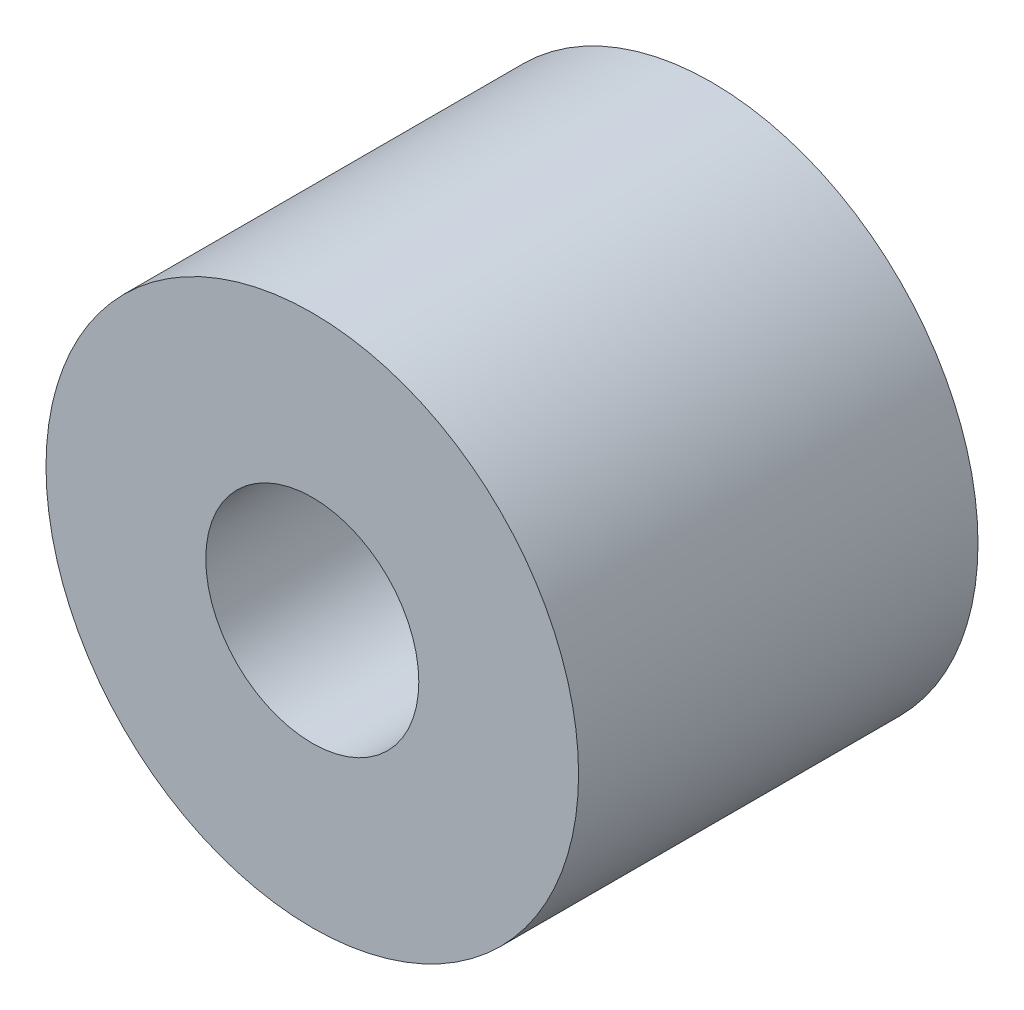
from build123d import *

# Parameters (mm, degrees)
ESBO_O1_R                = 4
ESBO_O1_R_2              = 1.6
RESSALTO_EXTRUS_O1_DEPTH = 3


with BuildPart() as part:
    # Esboço1 → Ressalto-extrusão1 (new, symmetric)
    with BuildSketch(Plane.XY):
        Circle(ESBO_O1_R)
        Circle(ESBO_O1_R_2, mode=Mode.SUBTRACT)
    extrude(amount=RESSALTO_EXTRUS_O1_DEPTH, both=True)


solid = part.part
